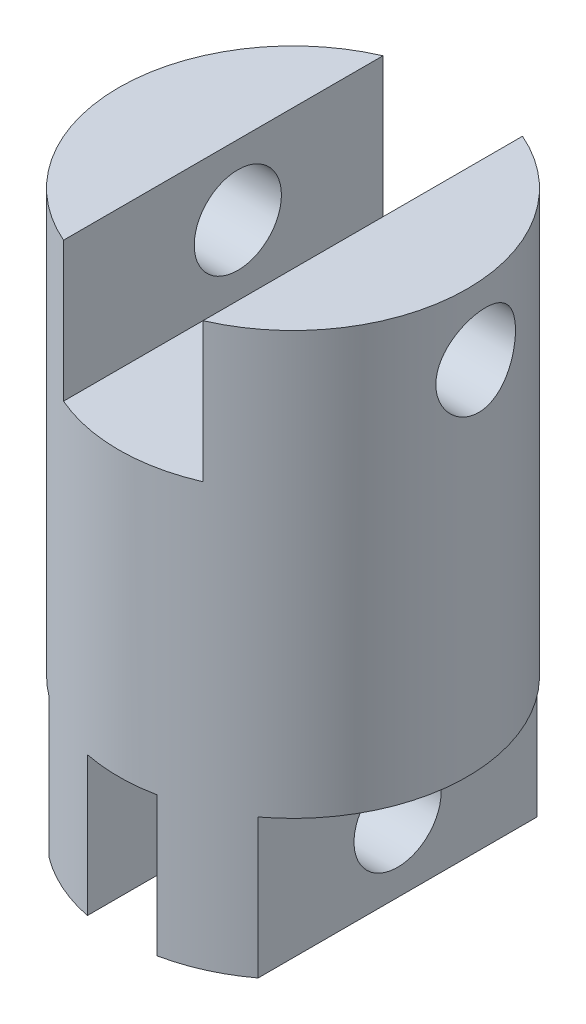
from build123d import *

# Parameters (mm, degrees)
SKETCH1_R               = 12.7
BOSS_EXTRUDE1_DEPTH     = 40.9448
CUT_EXTRUDE1_START      = -10.16
CUT_EXTRUDE1_DEPTH      = 10.16
CUT_EXTRUDE2_DEPTH      = 10.16
CUT_EXTRUDE3_DEPTH      = 47.410074844
CUT_EXTRUDE3_DEPTH_BACK = 47.410074844
SKETCH4_R               = 3.175
SKETCH5_R               = 2.54
CUT_EXTRUDE4_DEPTH      = 36.641042666


with BuildPart() as part:
    # Sketch1 → Boss-Extrude1 (new body)
    with BuildSketch(Plane(origin=(0, 0, 0), x_dir=(1, 0, 0), z_dir=(0, 1, 0))):
        with Locations(Location((0, 0, 0), (0, 0, 270))):
            Circle(SKETCH1_R)
    extrude(amount=BOSS_EXTRUDE1_DEPTH)

    # Sketch2 → Cut-Extrude1 (cut)
    with BuildSketch(Plane(origin=(0, 40.9448, 0), x_dir=(1, 0, 0), z_dir=(0, 1, 0)).offset(CUT_EXTRUDE1_START)):
        with BuildLine():
            Line((5.08, 11.639742265), (5.08, -11.639742265))
            ThreePointArc((5.08, -11.639742265), (0, -12.7), (-5.08, -11.639742265))
            Line((-5.08, -11.639742265), (-5.08, 11.639742265))
            ThreePointArc((-5.08, 11.639742265), (0, 12.7), (5.08, 11.639742265))
        make_face()
    extrude(amount=CUT_EXTRUDE1_DEPTH, mode=Mode.SUBTRACT)

    # Sketch3 → Cut-Extrude2 (cut)
    with BuildSketch(Plane.XZ):
        with BuildLine():
            Line((-2.54, 12.443407893), (-2.54, -12.443407893))
            ThreePointArc((-2.54, -12.443407893), (0, -12.7), (2.54, -12.443407893))
            Line((2.54, -12.443407893), (2.54, 12.443407893))
            ThreePointArc((2.54, 12.443407893), (0, 12.7), (-2.54, 12.443407893))
        make_face()
        with BuildLine():
            Line((-7.62, 10.16), (-7.62, -10.16))
            ThreePointArc((-7.62, -10.16), (-12.7, 0), (-7.62, 10.16))
        make_face()
        with BuildLine():
            Line((7.62, 10.16), (7.62, -10.16))
            ThreePointArc((7.62, -10.16), (12.7, 0), (7.62, 10.16))
        make_face()
    extrude(amount=-CUT_EXTRUDE2_DEPTH, mode=Mode.SUBTRACT)

    # Sketch4 → Cut-Extrude3 (cut, two sides: drawn at the far end of the back side and taken through both)
    with BuildSketch(Plane(origin=(-5.08, 0, 0), x_dir=(0, 0, -1), z_dir=(1, 0, 0)).offset(-CUT_EXTRUDE3_DEPTH_BACK)):
        with Locations((1.060257735, 35.8648)):
            Circle(SKETCH4_R)
        with Locations((0, 5.08)):
            Circle(SKETCH4_R)
    extrude(amount=CUT_EXTRUDE3_DEPTH + CUT_EXTRUDE3_DEPTH_BACK, mode=Mode.SUBTRACT)

    # Sketch5 → Cut-Extrude4 (cut, through all)
    with BuildSketch(Plane(origin=(0, 30.7848, 0), x_dir=(1, 0, 0), z_dir=(0, 1, 0))):
        with Locations(Location((0, 0, 0), (0, 0, 270))):
            Circle(SKETCH5_R)
    extrude(amount=-CUT_EXTRUDE4_DEPTH, mode=Mode.SUBTRACT)


solid = part.part
